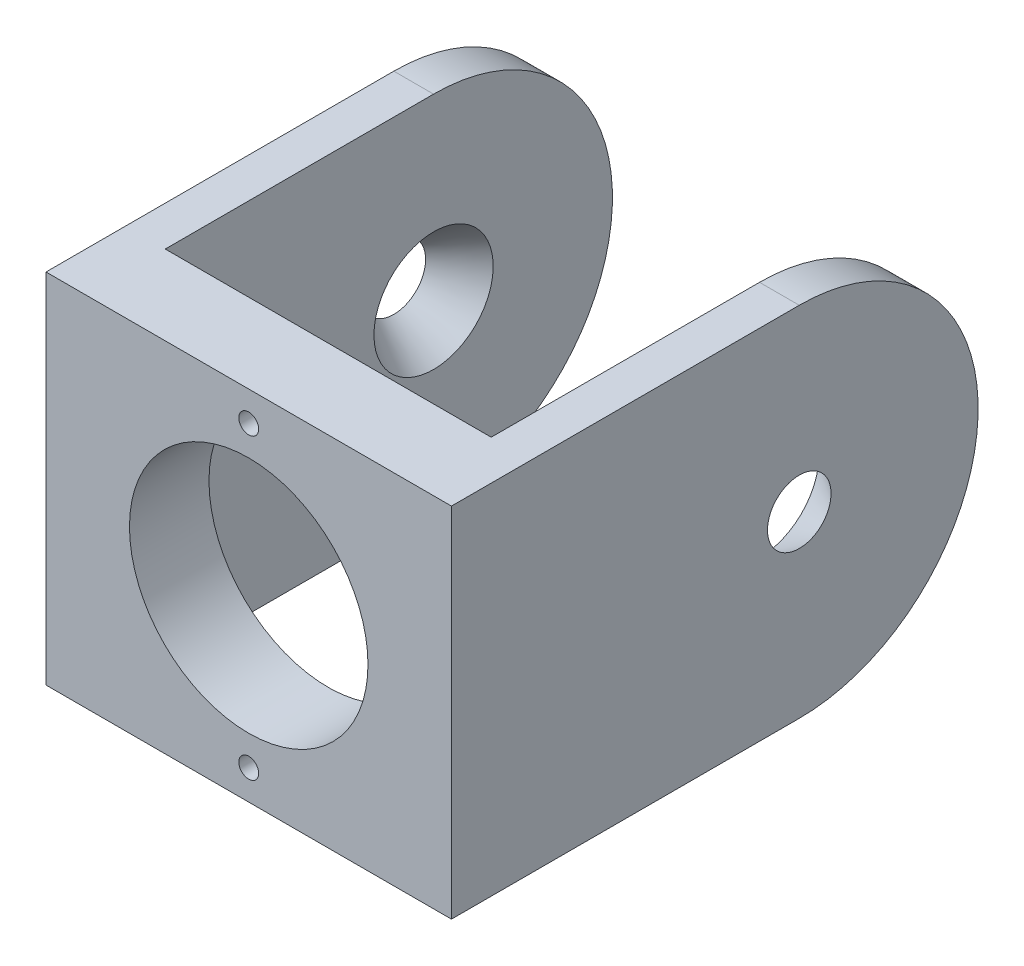
from build123d import *

# Parameters (mm, degrees)
SKETCH1_W               = 16
SKETCH1_H               = 18
SKETCH1_W_2             = 12
SKETCH1_H_2             = 14
EXTRUDE_THIN1_DEPTH     = 2
BOSS_EXTRUDE3_DEPTH     = 2.2
CUT_EXTRUDE4_REACH      = 34.067
SKETCH10_W              = 0.2
SKETCH10_H              = 27.531461486
SKETCH5_R               = 3
CUT_EXTRUDE1_DEPTH      = 2
CUT_EXTRUDE1_DRAFT      = -35
MIRROR3_COPY_1_SKETCH_R = 3
MIRROR3_COPY_1_DEPTH    = 2
MIRROR3_COPY_1_DRAFT    = -35
SKETCH14_W              = 12
SKETCH14_H              = 4
BOSS_EXTRUDE5_DEPTH     = 14
CUT_EXTRUDE6_REACH      = 28.292
SKETCH15_R              = 6
CUT_EXTRUDE8_REACH      = 28.292
SKETCH19_R              = 0.5


with BuildPart() as part:
    # Sketch1 → Extrude-Thin1 (new, symmetric)
    with BuildSketch(Plane.XY):
        Rectangle(SKETCH1_W, SKETCH1_H)
        Rectangle(SKETCH1_W_2, SKETCH1_H_2, mode=Mode.SUBTRACT)
    extrude_thin1 = extrude(amount=EXTRUDE_THIN1_DEPTH, both=True)

    # Sketch4 → Boss-Extrude3 (add)
    with BuildSketch(Plane(origin=(8, 0, 0), x_dir=(0, 0, -1), z_dir=(1, 0, 0))):
        with BuildLine():
            Line((-2, 9), (15.5, 9))
            ThreePointArc((15.5, 9), (24.5, 0), (15.5, -9))
            Line((15.5, -9), (-2, -9))
            Line((-2, -9), (-2, 9))
        make_face()
    boss_extrude3 = extrude(amount=BOSS_EXTRUDE3_DEPTH)

    # Sketch10 → Cut-Extrude4 (cut, up to next)
    with BuildSketch(Plane(origin=(0, 9, 0), x_dir=(1, 0, 0), z_dir=(0, 1, 0)), mode=Mode.PRIVATE) as cut_extrude4_sk1:
        with Locations((8.1, 15.765730743)):
            Rectangle(SKETCH10_W, SKETCH10_H)
    cut_extrude4_tool1 = extrude(cut_extrude4_sk1.sketch, amount=-CUT_EXTRUDE4_REACH, mode=Mode.PRIVATE) & part.part
    cut_extrude4 = cut_extrude4_tool1.solids().sort_by_distance((8.1, 9, -15.765731))[0]
    add(cut_extrude4, mode=Mode.SUBTRACT)


with BuildPart() as cut_extrude1_tool:
    # Sketch5 → Cut-Extrude1 (with draft: the straight prism first)
    with BuildSketch(Plane.ZY.offset(-8.2)):
        with Locations((-15.5, 0)):
            Circle(SKETCH5_R)
    extrude(amount=-CUT_EXTRUDE1_DEPTH)
    # Cut-Extrude1: the draft: its side faces are tilted about the plane it starts from
    cut_extrude1_sides = [cut_extrude1_tool.faces().sort_by_distance(p)[0] for p in [
        (9.2, 0, -18.5),
    ]]
    draft(cut_extrude1_sides, Plane.ZY.offset(-8.2), CUT_EXTRUDE1_DRAFT)


with BuildPart() as part_1:
    add(part.part)

    # Cut-Extrude1: cut by cut_extrude1_tool
    add(cut_extrude1_tool.part, mode=Mode.SUBTRACT)

    # Mirror3: Extrude-Thin1, Boss-Extrude3, Cut-Extrude4 across plane
    add(extrude_thin1.mirror(Plane(origin=(0, 0, 0), x_dir=(0, 0, 1), z_dir=(1, 0, 0))))
    add(boss_extrude3.mirror(Plane(origin=(0, 0, 0), x_dir=(0, 0, 1), z_dir=(1, 0, 0))))
    add(cut_extrude4.mirror(Plane(origin=(0, 0, 0), x_dir=(0, 0, 1), z_dir=(1, 0, 0))), mode=Mode.SUBTRACT)


with BuildPart() as mirror3_copy_1_tool:
    # Mirror3 copy 1 sketch → Mirror3 copy 1 (with draft: the straight prism first)
    with BuildSketch(Plane(origin=(-8.2, 0, 0), x_dir=(0, 0, 1), z_dir=(1, 0, 0))):
        with Locations((-15.5, 0)):
            Circle(MIRROR3_COPY_1_SKETCH_R)
    extrude(amount=-MIRROR3_COPY_1_DEPTH)
    # Mirror3 copy 1: the draft: its side faces are tilted about the plane it starts from
    mirror3_copy_1_sides = [mirror3_copy_1_tool.faces().sort_by_distance(p)[0] for p in [
        (-9.2, 0, -18.5),
    ]]
    draft(mirror3_copy_1_sides, Plane(origin=(-8.2, 0, 0), x_dir=(0, 0, 1), z_dir=(1, 0, 0)), MIRROR3_COPY_1_DRAFT)


with BuildPart() as part_2:
    add(part_1.part)

    # Mirror3 copy 1: cut by mirror3_copy_1_tool
    add(mirror3_copy_1_tool.part, mode=Mode.SUBTRACT)

    # Sketch14 → Boss-Extrude5 (add)
    with BuildSketch(Plane(origin=(0, -7, 0), x_dir=(1, 0, 0), z_dir=(0, 1, 0))):
        Rectangle(SKETCH14_W, SKETCH14_H)
    extrude(amount=BOSS_EXTRUDE5_DEPTH)

    # Sketch15 → Cut-Extrude6 (cut, up to next)
    with BuildSketch(Plane(origin=(0, 0, -2), x_dir=(-1, 0, 0), z_dir=(0, 0, -1)), mode=Mode.PRIVATE) as cut_extrude6_sk1:
        Circle(SKETCH15_R)
    cut_extrude6_tool1 = extrude(cut_extrude6_sk1.sketch, amount=-CUT_EXTRUDE6_REACH, mode=Mode.PRIVATE) & part_2.part
    add(cut_extrude6_tool1.solids().sort_by_distance((0, 0, -2))[0], mode=Mode.SUBTRACT)

    # Sketch19 → Cut-Extrude8 (cut, up to next)
    with BuildSketch(Plane(origin=(0, 0, -2), x_dir=(-1, 0, 0), z_dir=(0, 0, -1)), mode=Mode.PRIVATE) as cut_extrude8_sk1:
        with Locations((0, 7.5)):
            Circle(SKETCH19_R)
    cut_extrude8_tool1 = extrude(cut_extrude8_sk1.sketch, amount=-CUT_EXTRUDE8_REACH, mode=Mode.PRIVATE) & part_2.part
    cut_extrude8 = cut_extrude8_tool1.solids().sort_by_distance((0, 7.5, -2))[0]
    add(cut_extrude8, mode=Mode.SUBTRACT)

    # Mirror8: Cut-Extrude8 across plane
    add(cut_extrude8.mirror(Plane.ZX), mode=Mode.SUBTRACT)

    # Mirror8 at the second plane: Cut-Extrude8 across plane
    add(cut_extrude8.mirror(Plane(origin=(0, 0, 0), x_dir=(0, 0, 1), z_dir=(1, 0, 0))), mode=Mode.SUBTRACT)


solid = part_2.part
